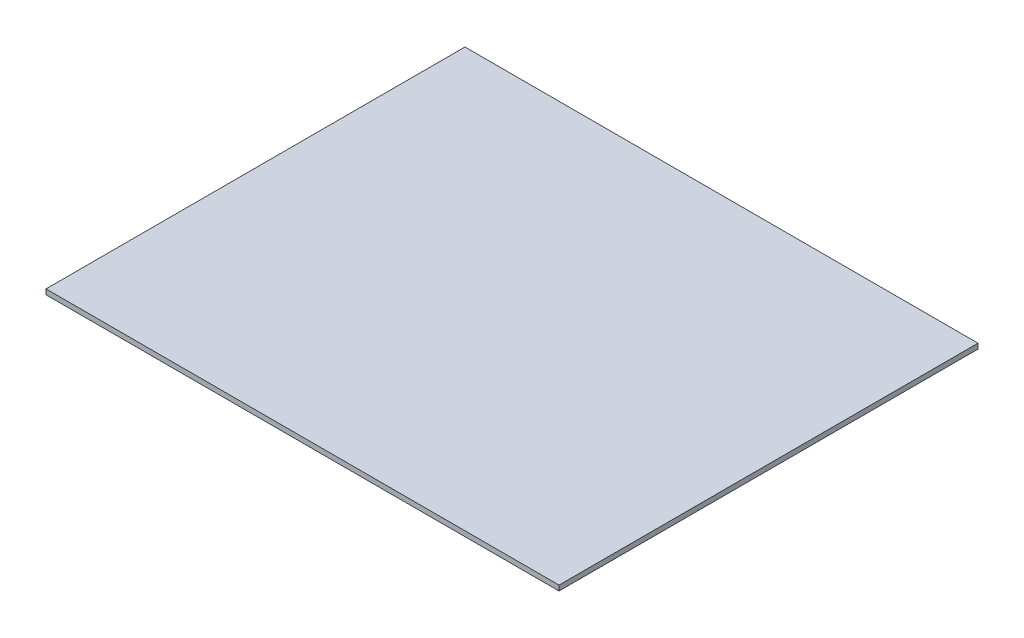
from build123d import *

# Parameters (mm, degrees)
SKETCH1_W           = 300
SKETCH1_H           = 245
BOSS_EXTRUDE1_DEPTH = 3


with BuildPart() as part:
    # Sketch1 → Boss-Extrude1 (new body)
    with BuildSketch(Plane(origin=(0, 0, 0), x_dir=(1, 0, 0), z_dir=(0, 1, 0))):
        with Locations((-95.684210526, -42.605263158)):
            Rectangle(SKETCH1_W, SKETCH1_H)
    extrude(amount=BOSS_EXTRUDE1_DEPTH)


solid = part.part
